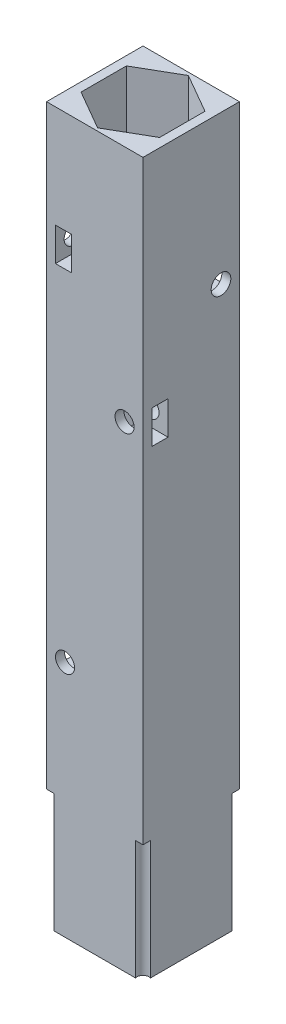
from build123d import *

# Parameters (mm, degrees)
SKETCH_1_W           = 16.2
SKETCH_1_H           = 16.2
SKETCH_1_R           = 4
EXTRUDE_1_DEPTH      = 120
SKETCH_2_R           = 1
CUT_EXTRUDE_1_DEPTH  = 20
CUT_EXTRUDE_2_DEPTH  = 10
SKETCH_4_R           = 1.6
CUT_EXTRUDE_3_DEPTH  = 10
CUT_EXTRUDE_4_DEPTH  = 2.7
SKETCH_6_R           = 1.65
CUT_EXTRUDE_5_DEPTH  = 10
CUT_EXTRUDE_6_DEPTH  = 2.7
SKETCH_9_R           = 1.65
CUT_EXTRUDE_7_DEPTH  = 10
CUT_EXTRUDE_8_DEPTH  = 2.7
SKETCH_11_R          = 1.65
CUT_EXTRUDE_9_DEPTH  = 10
CUT_EXTRUDE_10_DEPTH = 2.7


with BuildPart() as part:
    # Эскиз1 → Бобышка-Вытянуть1 (new body)
    with BuildSketch(Plane(origin=(0, 0, 0), x_dir=(1, 0, 0), z_dir=(0, 1, 0))):
        Rectangle(SKETCH_1_W, SKETCH_1_H)
        with Locations(Location((0, 0, 0), (0, 0, 270))):
            Circle(SKETCH_1_R, mode=Mode.SUBTRACT)
    extrude(amount=EXTRUDE_1_DEPTH)

    # Эскиз2 → Вырез-Вытянуть1 (cut)
    with BuildSketch(Plane.XZ):
        with Locations((-7.8, -7.8)):
            Circle(SKETCH_2_R)
        with Locations((-7.8, 7.8)):
            Circle(SKETCH_2_R)
        with Locations((7.8, 7.8)):
            Circle(SKETCH_2_R)
        with Locations((7.8, -7.8)):
            Circle(SKETCH_2_R)
    extrude(amount=-CUT_EXTRUDE_1_DEPTH, mode=Mode.SUBTRACT)

    # Эскиз3 → Вырез-Вытянуть2 (cut)
    with BuildSketch(Plane(origin=(0, 120, 0), x_dir=(1, 0, 0), z_dir=(0, 1, 0))):
        Polygon((0, 7.621023553), (-6.6, 3.810511777), (-6.6, -3.810511777), (0, -7.621023553), (6.6, -3.810511777), (6.6, 3.810511777), align=None)
    extrude(amount=-CUT_EXTRUDE_2_DEPTH, mode=Mode.SUBTRACT)

    # Эскиз4 → Вырез-Вытянуть3 (cut)
    with BuildSketch(Plane.XY.offset(8.1)):
        with Locations((-5, 40)):
            Circle(SKETCH_4_R)
        with Locations((5, 80)):
            Circle(SKETCH_4_R)
    extrude(amount=-CUT_EXTRUDE_3_DEPTH, mode=Mode.SUBTRACT)

    # Эскиз5 → Вырез-Вытянуть4 (cut)
    with BuildSketch(Plane.XY.offset(6.6)):
        Polygon((-6.616580754, 42.8), (-8.1, 42.8), (-8.1, 37.2), (-6.616580754, 37.2), (-3.383419246, 37.2), (-1.766838493, 40), (-3.383419246, 42.8), align=None)
        Polygon((6.616580754, 82.8), (8.1, 82.8), (8.1, 77.2), (6.616580754, 77.2), (3.383419246, 77.2), (1.766838493, 80), (3.383419246, 82.8), align=None)
    extrude(amount=-CUT_EXTRUDE_4_DEPTH, mode=Mode.SUBTRACT)

    # Эскиз6 → Вырез-Вытянуть5 (cut)
    with BuildSketch(Plane(origin=(0, 0, -8.1), x_dir=(-1, 0, 0), z_dir=(0, 0, -1))):
        with Locations((5, 105)):
            Circle(SKETCH_6_R)
    extrude(amount=-CUT_EXTRUDE_5_DEPTH, mode=Mode.SUBTRACT)

    # Эскиз7 → Вырез-Вытянуть6 (cut)
    with BuildSketch(Plane(origin=(0, 0, -6.6), x_dir=(-1, 0, 0), z_dir=(0, 0, -1))):
        Polygon((6.616580754, 107.8), (8.1, 107.8), (8.1, 102.2), (6.616580754, 102.2), (3.383419246, 102.2), (1.766838493, 105), (3.383419246, 107.8), align=None)
    extrude(amount=-CUT_EXTRUDE_6_DEPTH, mode=Mode.SUBTRACT)

    # Эскиз9 → Вырез-Вытянуть7 (cut)
    with BuildSketch(Plane.ZY.offset(8.1)):
        with Locations((5, 100)):
            Circle(SKETCH_9_R)
    extrude(amount=-CUT_EXTRUDE_7_DEPTH, mode=Mode.SUBTRACT)

    # Эскиз10 → Вырез-Вытянуть8 (cut)
    with BuildSketch(Plane.ZY.offset(6.6)):
        Polygon((6.616580754, 102.8), (8.1, 102.8), (8.1, 97.2), (6.616580754, 97.2), (3.383419246, 97.2), (1.766838493, 100), (3.383419246, 102.8), align=None)
    extrude(amount=-CUT_EXTRUDE_8_DEPTH, mode=Mode.SUBTRACT)

    # Эскиз11 → Вырез-Вытянуть9 (cut)
    with BuildSketch(Plane(origin=(8.1, 0, 0), x_dir=(0, 0, -1), z_dir=(1, 0, 0))):
        with Locations((5, 95)):
            Circle(SKETCH_11_R)
    extrude(amount=-CUT_EXTRUDE_9_DEPTH, mode=Mode.SUBTRACT)

    # Эскиз12 → Вырез-Вытянуть10 (cut)
    with BuildSketch(Plane(origin=(6.6, 0, 0), x_dir=(0, 0, -1), z_dir=(1, 0, 0))):
        Polygon((6.616580754, 97.8), (8.1, 97.8), (8.1, 92.2), (6.616580754, 92.2), (3.383419246, 92.2), (1.766838493, 95), (3.383419246, 97.8), align=None)
    extrude(amount=-CUT_EXTRUDE_10_DEPTH, mode=Mode.SUBTRACT)


solid = part.part
